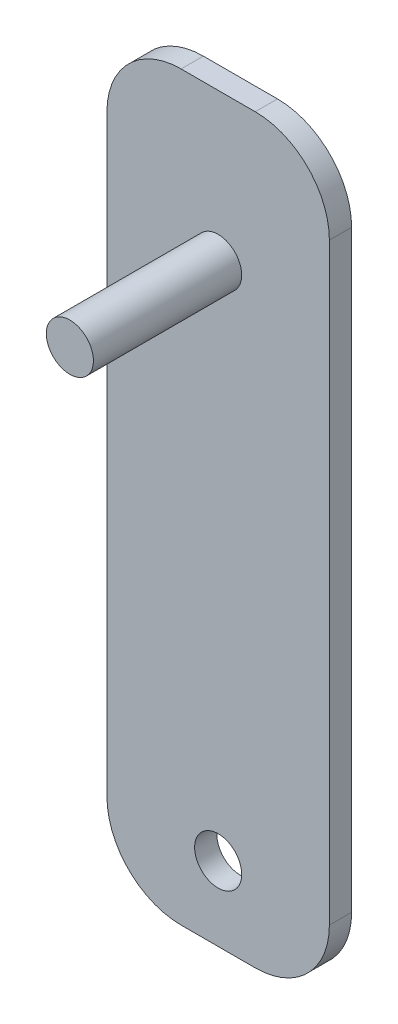
from build123d import *

# Parameters (mm, degrees)
CROQUIS1_R              = 3.175
SALIENTE_EXTRUIR1_DEPTH = 3
CROQUIS2_R              = 3.175
SALIENTE_EXTRUIR2_DEPTH = 20


with BuildPart() as part:
    # Croquis1 → Saliente-Extruir1 (new body)
    with BuildSketch(Plane.XY):
        with BuildLine():
            Line((5, -50), (-5, -50))
            ThreePointArc((-5, -50), (-12.071067812, -47.071067812), (-15, -40))
            Line((-15, -40), (-15, 40))
            ThreePointArc((-15, 40), (-12.071067812, 47.071067812), (-5, 50))
            Line((-5, 50), (5, 50))
            ThreePointArc((5, 50), (12.071067812, 47.071067812), (15, 40))
            Line((15, 40), (15, -40))
            ThreePointArc((15, -40), (12.071067812, -47.071067812), (5, -50))
        make_face()
        with Locations((0, -40)):
            Circle(CROQUIS1_R, mode=Mode.SUBTRACT)
    extrude(amount=SALIENTE_EXTRUIR1_DEPTH)

    # Croquis2 → Saliente-Extruir2 (add)
    with BuildSketch(Plane.XY.offset(3)):
        with Locations((0, 30)):
            Circle(CROQUIS2_R)
    extrude(amount=SALIENTE_EXTRUIR2_DEPTH)


solid = part.part
